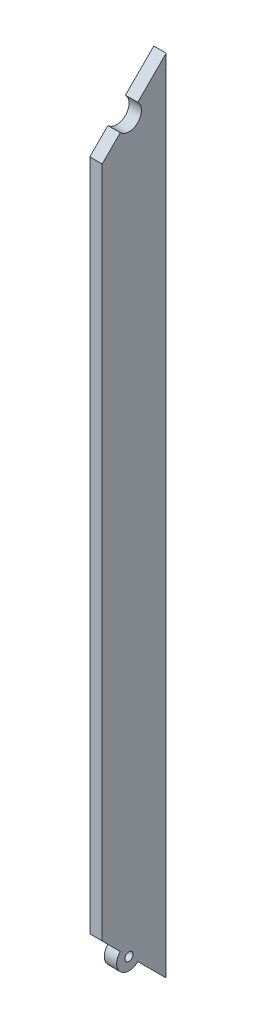
from build123d import *

# Parameters (mm, degrees)
BOSS_EXTRUDE1_DEPTH = 6
SKETCH4_R           = 6
BOSS_EXTRUDE2_DEPTH = 6
SKETCH3_R           = 6
SKETCH3_R_2         = 2
CUT_EXTRUDE1_DEPTH  = 383.864205692


with BuildPart() as part:
    # Sketch2 → Boss-Extrude1 (new body)
    with BuildSketch(Plane(origin=(0, 0, 0), x_dir=(0, 0, -1), z_dir=(1, 0, 0))):
        Polygon((6, 382), (-25, 351), (-25, 25), (6, -6), align=None)
    extrude(amount=BOSS_EXTRUDE1_DEPTH)

    # Sketch4 → Boss-Extrude2 (add)
    with BuildSketch(Plane.ZY):
        with Locations((12, 12)):
            Circle(SKETCH4_R)
    extrude(amount=-BOSS_EXTRUDE2_DEPTH)

    # Sketch3 → Cut-Extrude1 (cut, through all)
    with BuildSketch(Plane(origin=(0, 0, 0), x_dir=(0, 0, -1), z_dir=(1, 0, 0))):
        with Locations((-12, 364)):
            Circle(SKETCH3_R)
        with Locations((-12, 12)):
            Circle(SKETCH3_R_2)
    extrude(amount=CUT_EXTRUDE1_DEPTH, mode=Mode.SUBTRACT)


solid = part.part
